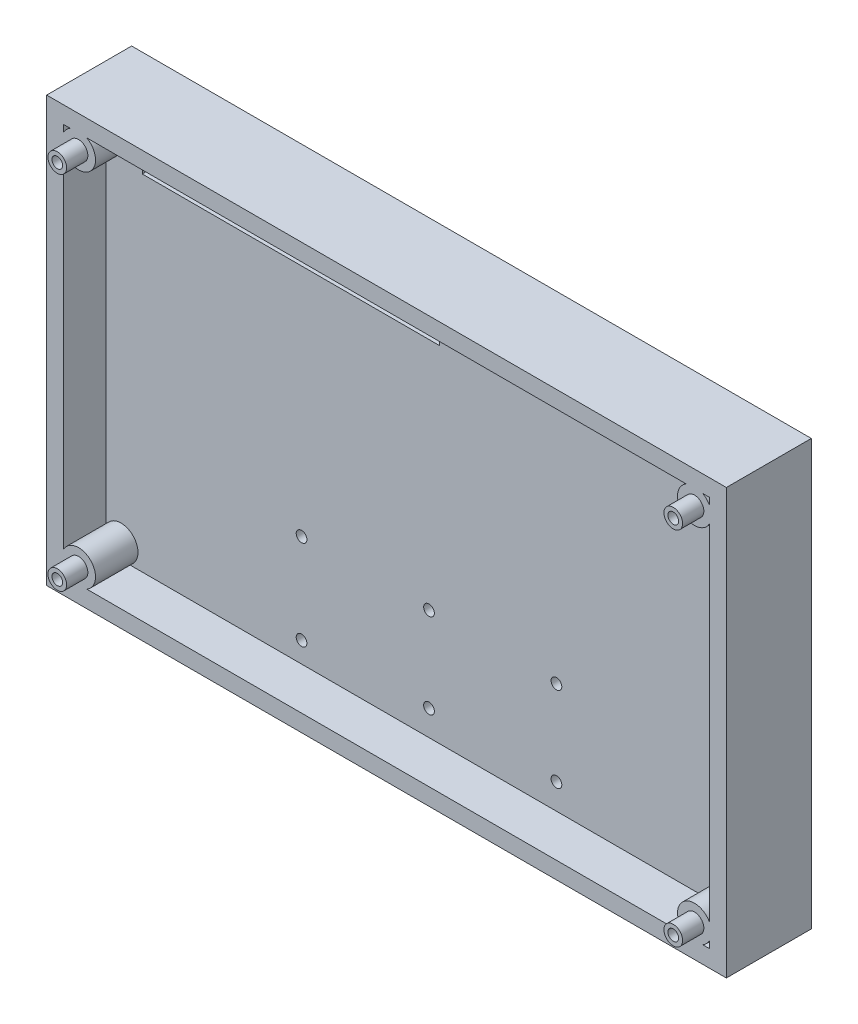
from build123d import *

# Parameters (mm, degrees)
SKETCH2_W                 = 101.6
SKETCH2_H                 = 63.5
BOSS_EXTRUDE1_DEPTH       = 6.35
SKETCH3_R                 = 2.54
BOSS_EXTRUDE2_DEPTH       = 6.35
SKETCH4_R                 = 1.397
BOSS_EXTRUDE3_DEPTH       = 3.175
M2X0_4_TAPPED_HOLE1_D     = 1.6
M2X0_4_TAPPED_HOLE1_DEPTH = 5.2639976
M2X0_4_TAPPED_HOLE1_TIP   = 0.480688495
SKETCH8_W                 = 44.45
SKETCH8_H                 = 6.35
CUT_EXTRUDE1_DEPTH        = 8.255
BOSS_EXTRUDE5_DEPTH       = 6.35
M2X0_4_TAPPED_HOLE2_D     = 1.6


with BuildPart() as part:
    # Sketch2 → Boss-Extrude1 (new body)
    with BuildSketch(Plane.XY):
        with Locations((50.8, 31.75)):
            Rectangle(SKETCH2_W, SKETCH2_H)
    extrude(amount=BOSS_EXTRUDE1_DEPTH)

    # Sketch3 → Boss-Extrude2 (add)
    with BuildSketch(Plane.XY.offset(6.35)):
        with Locations(Location((4.7625, 4.7625, 0), (0, 0, 180))):
            Circle(SKETCH3_R)
        with Locations(Location((96.8375, 4.7625, 0), (0, 0, 180))):
            Circle(SKETCH3_R)
        with Locations(Location((96.8375, 58.7375, 0), (0, 0, 180))):
            Circle(SKETCH3_R)
        with Locations(Location((4.7625, 58.7375, 0), (0, 0, 180))):
            Circle(SKETCH3_R)
    extrude(amount=BOSS_EXTRUDE2_DEPTH)

    # Sketch4 → Boss-Extrude3 (add)
    with BuildSketch(Plane.XY.offset(12.7)):
        with Locations((4.7625, 58.7375)):
            Circle(SKETCH4_R)
        with Locations((4.7625, 4.7625)):
            Circle(SKETCH4_R)
        with Locations((96.8375, 58.7375)):
            Circle(SKETCH4_R)
        with Locations((96.8375, 4.7625)):
            Circle(SKETCH4_R)
    extrude(amount=BOSS_EXTRUDE3_DEPTH)

    # M2x0.4 Tapped Hole1
    with Locations(Plane.XY.offset(15.875)):
        with Locations((4.7625, 58.7375), (4.7625, 4.7625), (96.8375, 58.7375), (96.8375, 4.7625)):
            Hole(M2X0_4_TAPPED_HOLE1_D / 2, depth=M2X0_4_TAPPED_HOLE1_DEPTH)
            with Locations((0, 0, -(M2X0_4_TAPPED_HOLE1_DEPTH + M2X0_4_TAPPED_HOLE1_TIP / 2))):  # 118° drill point
                Cone(0, M2X0_4_TAPPED_HOLE1_D / 2, M2X0_4_TAPPED_HOLE1_TIP, mode=Mode.SUBTRACT)

    # Sketch8 → Cut-Extrude1 (cut)
    with BuildSketch(Plane.XY.offset(6.35)):
        with Locations((30.1625, 57.253105079)):
            Rectangle(SKETCH8_W, SKETCH8_H)
    extrude(amount=-CUT_EXTRUDE1_DEPTH, mode=Mode.SUBTRACT)

    # 3DSketch1 → Boss-Extrude5 (add)
    with BuildSketch(Plane(origin=(2.54, 2.54, 6.35), x_dir=(0.851658316704544, 0.5240974256643347, 0), z_dir=(0, 0, -1))):
        Polygon((83.034065392, 54.080303111), (116.314251921, 0), (29.785766944, -53.248298447), (-3.494419586, 0.832004663), align=None)
        Polygon((0, 0), (82.202060728, 50.585883525), (112.819832336, 0.832004663), (30.617771607, -49.753878862), align=None, mode=Mode.SUBTRACT)
    extrude(amount=-BOSS_EXTRUDE5_DEPTH)

    # M2x0.4 Tapped Hole2 (through all)
    with Locations(Plane(origin=(0, 0, 0), x_dir=(-1, 0, 0), z_dir=(0, 0, -1))):
        with Locations((-69.85, 19.05), (-50.8, 19.05), (-31.75, 19.05), (-69.85, 6.35), (-50.8, 6.35), (-31.75, 5.62052836)):
            Hole(M2X0_4_TAPPED_HOLE2_D / 2)


solid = part.part
